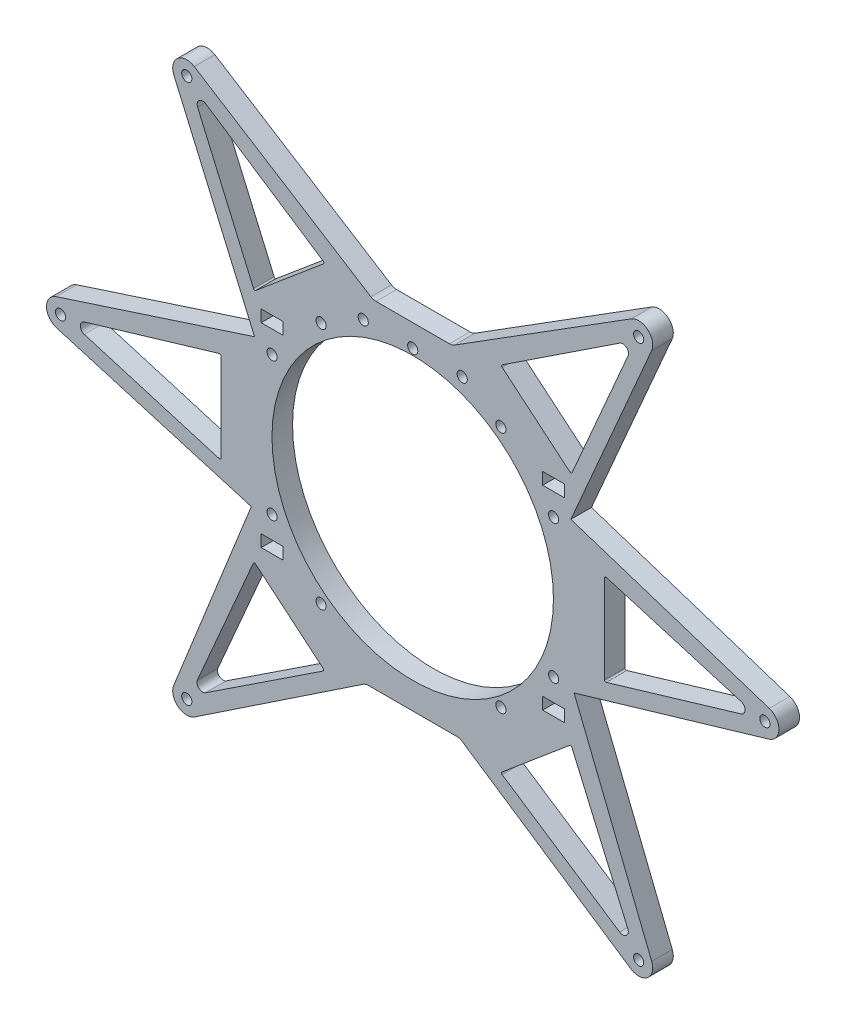
from build123d import *

# Parameters (mm, degrees)
SKETCH1_R            = 1.450000006
SKETCH1_R_2          = 1.449941928
SKETCH1_W            = 6.2
SKETCH1_H            = 3.4
SKETCH1_R_3          = 1.450000003
SKETCH1_R_4          = 40
SKETCH1_R_5          = 1.45
BOSS_EXTRUDE11_DEPTH = 5.85


with BuildPart() as part:
    # Sketch1 → Boss-Extrude11 (new body)
    with BuildSketch(Plane.XY):
        with BuildLine():
            ThreePointArc((639.724883257, 499.569822456), (638.966034957, 499.676986361), (638.266537412, 499.990096614))
            Line((638.266537412, 499.990096614), (588.077856055, 531.537433899))
            ThreePointArc((588.077856055, 531.537433899), (583.344226303, 531.18640109), (582.27874868, 526.560903053))
            Line((582.27874868, 526.560903053), (605.213170633, 473.617916038))
            Line((605.213170633, 473.617916038), (548.836184659, 455.29378772))
            ThreePointArc((548.836184659, 455.29378772), (546.073009962, 451.434339541), (548.941914767, 447.652823988))
            Line((548.941914767, 447.652823988), (554.763084266, 445.937340724))
            Line((554.763084266, 445.937340724), (596.245460931, 433.712593969))
            Line((596.245460931, 433.712593969), (599.290728508, 432.815161663))
            Line((599.290728508, 432.815161663), (604.285764635, 431.343137719))
            Line((604.285764635, 431.343137719), (582.236160138, 376.31629729))
            ThreePointArc((582.236160138, 376.31629729), (583.429213887, 371.72205117), (588.170744102, 371.502128745))
            Line((588.170744102, 371.502128745), (592.100192099, 374.12650821))
            Line((592.100192099, 374.12650821), (603.596221534, 381.804417066))
            Line((603.596221534, 381.804417066), (636.150805744, 403.546804888))
            ThreePointArc((636.150805744, 403.546804888), (636.852224463, 403.859925316), (637.612849666, 403.967079047))
            Line((637.612849666, 403.967079047), (662.711272535, 403.967079047))
            ThreePointArc((662.711272535, 403.967079047), (663.470120836, 403.859915142), (664.16961838, 403.546804888))
            Line((664.16961838, 403.546804888), (712.149680023, 371.502128745))
            ThreePointArc((712.149680023, 371.502128745), (716.891210238, 371.72205117), (718.084263987, 376.31629729))
            Line((718.084263987, 376.31629729), (696.03465949, 431.343137719))
            Line((696.03465949, 431.343137719), (751.378509358, 447.652823988))
            ThreePointArc((751.378509358, 447.652823988), (754.247414163, 451.434339541), (751.484239466, 455.29378772))
            Line((751.484239466, 455.29378772), (745.965056767, 457.087679505))
            Line((745.965056767, 457.087679505), (702.479915956, 471.221590468))
            Line((702.479915956, 471.221590468), (695.107253492, 473.617916038))
            Line((695.107253492, 473.617916038), (701.597430802, 488.600171695))
            Line((701.597430802, 488.600171695), (702.867715773, 491.532562182))
            Line((702.867715773, 491.532562182), (714.311493474, 517.949961123))
            Line((714.311493474, 517.949961123), (718.041675445, 526.560903053))
            ThreePointArc((718.041675445, 526.560903053), (716.976197822, 531.18640109), (712.24256807, 531.537433899))
            Line((712.24256807, 531.537433899), (662.053886713, 499.990096614))
            ThreePointArc((662.053886713, 499.990096614), (661.354389168, 499.676986361), (660.595540868, 499.569822456))
            Line((660.595540868, 499.569822456), (639.724883257, 499.569822456))
        make_face()
        with Locations((585.949161838, 374.828473923)):
            Circle(SKETCH1_R, mode=Mode.SUBTRACT)
        with BuildLine():
            Line((624.68020842, 401.06117225), (591.294683214, 379.029224839))
            ThreePointArc((591.294683214, 379.029224839), (589.396544209, 379.138356483), (588.959649961, 380.988752337))
            Line((588.959649961, 380.988752337), (590.118736999, 383.663703413))
            Line((590.118736999, 383.663703413), (604.863272518, 417.69126982))
            ThreePointArc((604.863272518, 417.69126982), (605.13587571, 417.91953965), (605.481867106, 417.837627687))
            Line((605.481867106, 417.837627687), (624.718077603, 401.725200151))
            ThreePointArc((624.718077603, 401.725200151), (624.865817134, 401.383680858), (624.68020842, 401.06117225))
        make_face(mode=Mode.SUBTRACT)
        with Locations((624.115265697, 417.388768355)):
            Circle(SKETCH1_R_2, mode=Mode.SUBTRACT)
        with Locations((610.19862014, 424.360721889)):
            Rectangle(SKETCH1_W, SKETCH1_H, mode=Mode.SUBTRACT)
        with Locations((610.19862014, 432.360721889)):
            Circle(SKETCH1_R_3, mode=Mode.SUBTRACT)
        with Locations((650.160212062, 451.489683338)):
            Circle(SKETCH1_R_4, mode=Mode.SUBTRACT)
        with BuildLine():
            ThreePointArc((694.750680645, 417.792560251), (695.112666193, 417.878751085), (695.398044556, 417.639959152))
            Line((695.398044556, 417.639959152), (709.259881072, 385.64059016))
            Line((709.259881072, 385.64059016), (711.297941568, 380.935827572))
            ThreePointArc((711.297941568, 380.935827572), (710.860859499, 379.085476074), (708.962709426, 378.9765371))
            Line((708.962709426, 378.9765371), (675.579420729, 401.011873172))
            ThreePointArc((675.579420729, 401.011873172), (675.401955879, 401.319973549), (675.54270419, 401.646484695))
            Line((675.54270419, 401.646484695), (694.750680645, 417.792560251))
        make_face(mode=Mode.SUBTRACT)
        with Locations((714.371262287, 374.828473923)):
            Circle(SKETCH1_R, mode=Mode.SUBTRACT)
        with Locations((675.215266265, 417.413768355)):
            Circle(SKETCH1_R_2, mode=Mode.SUBTRACT)
        with Locations((690.19862014, 424.360721889)):
            Rectangle(SKETCH1_W, SKETCH1_H, mode=Mode.SUBTRACT)
        with Locations((690.19862014, 432.360721889)):
            Circle(SKETCH1_R_3, mode=Mode.SUBTRACT)
        with BuildLine():
            Line((704.657868853, 438.89520987), (704.635906667, 463.98787081))
            ThreePointArc((704.635906667, 463.98787081), (704.802560484, 464.320570227), (705.168923392, 464.38569024))
            Line((705.168923392, 464.38569024), (743.506176223, 452.972756989))
            ThreePointArc((743.506176223, 452.972756989), (744.642676768, 451.448549682), (743.506021515, 449.924457744))
            Line((743.506021515, 449.924457744), (705.167610421, 438.515415947))
            ThreePointArc((705.167610421, 438.515415947), (704.817519632, 438.577513089), (704.657868853, 438.89520987))
        make_face(mode=Mode.SUBTRACT)
        with Locations((750.247797049, 451.489683338)):
            Circle(SKETCH1_R, mode=Mode.SUBTRACT)
        with Locations((550.072627076, 451.489683338)):
            Circle(SKETCH1_R, mode=Mode.SUBTRACT)
        with BuildLine():
            Line((595.662555272, 464.084156807), (595.684517458, 438.991495867))
            ThreePointArc((595.684517458, 438.991495867), (595.517863641, 438.65879645), (595.151500732, 438.593676437))
            Line((595.151500732, 438.593676437), (556.814247902, 450.006609688))
            ThreePointArc((556.814247902, 450.006609688), (555.677747357, 451.530816994), (556.81440261, 453.054908933))
            Line((556.81440261, 453.054908933), (560.257551409, 454.079547864))
            Line((560.257551409, 454.079547864), (595.152813704, 464.46395073))
            ThreePointArc((595.152813704, 464.46395073), (595.502904493, 464.401853588), (595.662555272, 464.084156807))
        make_face(mode=Mode.SUBTRACT)
        with Locations((610.19862014, 471.710721889)):
            Circle(SKETCH1_R_3, mode=Mode.SUBTRACT)
        with Locations((610.19862014, 479.710721889)):
            Rectangle(SKETCH1_W, SKETCH1_H, mode=Mode.SUBTRACT)
        with Locations((624.115265697, 486.43876853)):
            Circle(SKETCH1_R_2, mode=Mode.SUBTRACT)
        with Locations((585.949161838, 528.150892754)):
            Circle(SKETCH1_R, mode=Mode.SUBTRACT)
        with BuildLine():
            Line((604.922379569, 485.339407525), (589.022482557, 522.043539105))
            ThreePointArc((589.022482557, 522.043539105), (589.459564626, 523.893890603), (591.357714699, 524.002829577))
            Line((591.357714699, 524.002829577), (596.297768126, 520.742044264))
            Line((596.297768126, 520.742044264), (624.741003396, 501.967493505))
            ThreePointArc((624.741003396, 501.967493505), (624.918468246, 501.659393128), (624.777719935, 501.332881982))
            Line((624.777719935, 501.332881982), (605.56974348, 485.186806426))
            ThreePointArc((605.56974348, 485.186806426), (605.207757932, 485.100615592), (604.922379569, 485.339407525))
        make_face(mode=Mode.SUBTRACT)
        with Locations((636.087236238, 493.259844204)):
            Circle(SKETCH1_R_5, mode=Mode.SUBTRACT)
        with Locations((650.160212062, 493.259844204)):
            Circle(SKETCH1_R_5, mode=Mode.SUBTRACT)
        with Locations((675.215266265, 486.46376853)):
            Circle(SKETCH1_R_2, mode=Mode.SUBTRACT)
        with Locations((690.19862014, 471.710721889)):
            Circle(SKETCH1_R_3, mode=Mode.SUBTRACT)
        with Locations((690.19862014, 479.710721889)):
            Rectangle(SKETCH1_W, SKETCH1_H, mode=Mode.SUBTRACT)
        with Locations((664.233187887, 493.259844204)):
            Circle(SKETCH1_R_5, mode=Mode.SUBTRACT)
        with BuildLine():
            ThreePointArc((709.025740911, 523.950141838), (710.923879916, 523.841010194), (711.360774164, 521.99061434))
            Line((711.360774164, 521.99061434), (710.94300028, 521.026472162))
            Line((710.94300028, 521.026472162), (697.668691106, 490.391906812))
            Line((697.668691106, 490.391906812), (695.457151607, 485.288096857))
            ThreePointArc((695.457151607, 485.288096857), (695.184548415, 485.059827027), (694.838557019, 485.14173899))
            Line((694.838557019, 485.14173899), (675.602346522, 501.254166526))
            ThreePointArc((675.602346522, 501.254166526), (675.454606991, 501.595685819), (675.640215705, 501.918194427))
            Line((675.640215705, 501.918194427), (709.025740911, 523.950141838))
        make_face(mode=Mode.SUBTRACT)
        with Locations((714.371262287, 528.150892754)):
            Circle(SKETCH1_R, mode=Mode.SUBTRACT)
    extrude(amount=BOSS_EXTRUDE11_DEPTH)


solid = part.part
